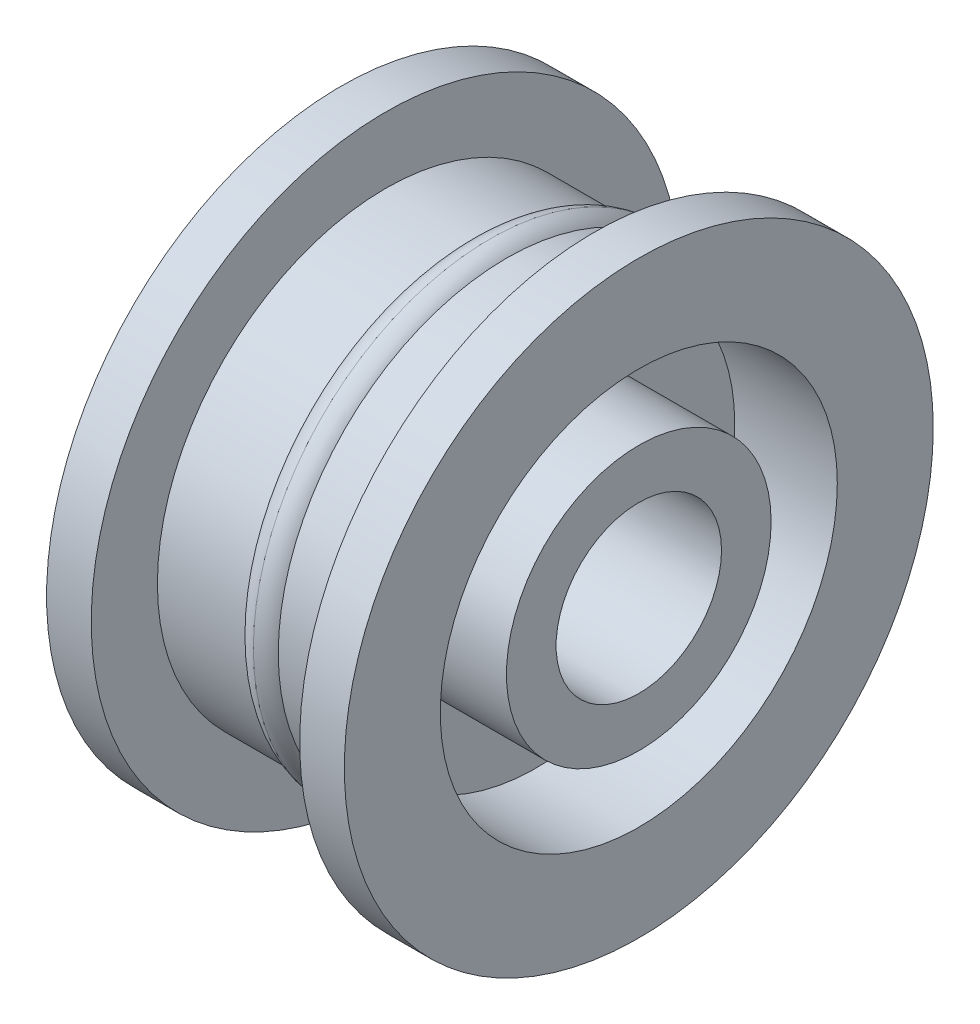
from build123d import *


with BuildPart() as part:
    # Эскиз1 → Повернуть1 (revolve)
    with BuildSketch(Plane.XY, mode=Mode.PRIVATE) as revolve_1_sk:
        Polygon((-9, 5), (9, 5), (9, 8), (2.8, 8), (2.8, 12), (9, 12), (9, 17.8), (6.3, 17.8), (6.3, 13.8), (1.3, 13.8), (-1.3, 13.8), (-6.3, 13.8), (-6.3, 17.8), (-9, 17.8), (-9, 12), (-2.8, 12), (-2.8, 8), (-9, 8), align=None)
    revolve(revolve_1_sk.sketch.rotate(Axis((0, 0, 0), (-1, 0, 0)), 90), axis=Axis((0, 0, 0), (-1, 0, 0)))

    # Эскиз2 → Повернуть2 (revolve)
    with BuildSketch(Plane.XY, mode=Mode.PRIVATE) as revolve_2_sk:
        with BuildLine():
            Line((-1.3, 13.3), (1.3, 13.3))
            ThreePointArc((1.3, 13.3), (0.798778164, 13.993411613), (0, 14.3))
            ThreePointArc((0, 14.3), (-0.798778164, 13.993411613), (-1.3, 13.3))
        make_face()
    revolve(revolve_2_sk.sketch.rotate(Axis((0, 0, 0), (1, 0, 0)), 270), axis=Axis((0, 0, 0), (1, 0, 0)))


solid = part.part
